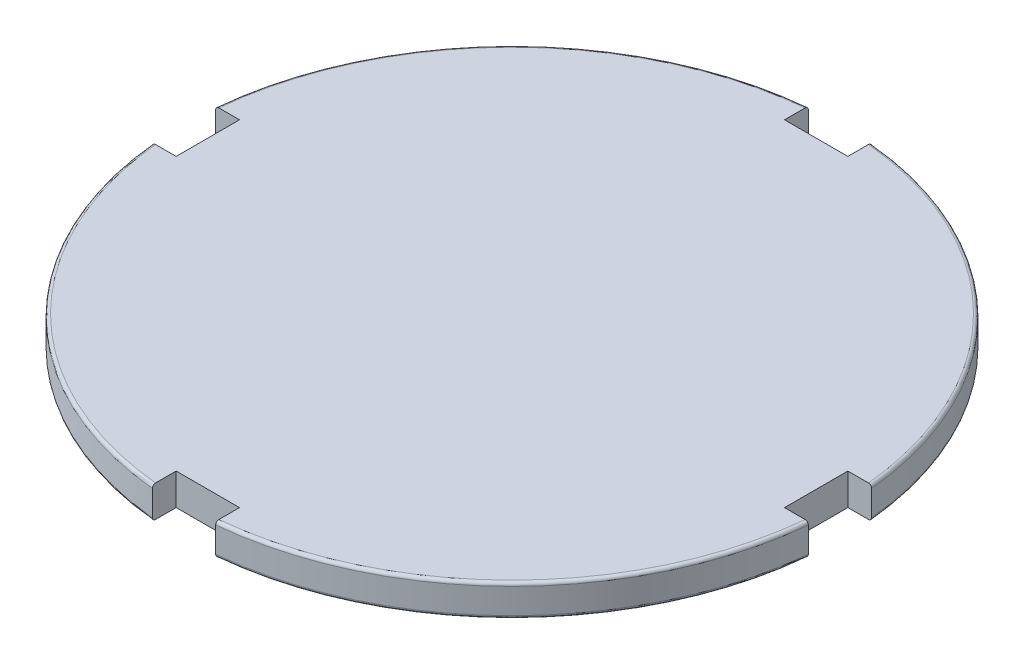
from build123d import *

# Parameters (mm, degrees)
SKETCH2_R           = 66.04
BOSS_EXTRUDE1_DEPTH = 6.35
FILLET1_R           = 0.635
SKETCH4_W           = 13.950963387
SKETCH4_H           = 12.7
SKETCH4_W_2         = 12.7
SKETCH4_H_2         = 13.950963387
CUT_EXTRUDE1_DEPTH  = 94.610286294


with BuildPart() as part:
    # Sketch2 → Boss-Extrude1 (new body)
    with BuildSketch(Plane(origin=(0, 0, 0), x_dir=(1, 0, 0), z_dir=(0, 1, 0))):
        with Locations(Location((0, 0, 0), (0, 0, 270))):
            Circle(SKETCH2_R)
    extrude(amount=BOSS_EXTRUDE1_DEPTH)

    # Fillet1
    fillet1_edges = [part.edges().sort_by_distance(p)[0] for p in [
        (0, 0, -66.04),
        (0, 6.35, -66.04),
    ]]
    fillet(fillet1_edges, radius=FILLET1_R)

    # Sketch4 → Cut-Extrude1 (cut, through all)
    with BuildSketch(Plane.XZ):
        with Locations((67.935481694, 0)):
            Rectangle(SKETCH4_W, SKETCH4_H)
        with Locations((0, -67.935481694)):
            Rectangle(SKETCH4_W_2, SKETCH4_H_2)
        with Locations((-67.935481694, 0)):
            Rectangle(SKETCH4_W, SKETCH4_H)
        with Locations((0, 67.935481694)):
            Rectangle(SKETCH4_W_2, SKETCH4_H_2)
    extrude(amount=-CUT_EXTRUDE1_DEPTH, mode=Mode.SUBTRACT)


solid = part.part
